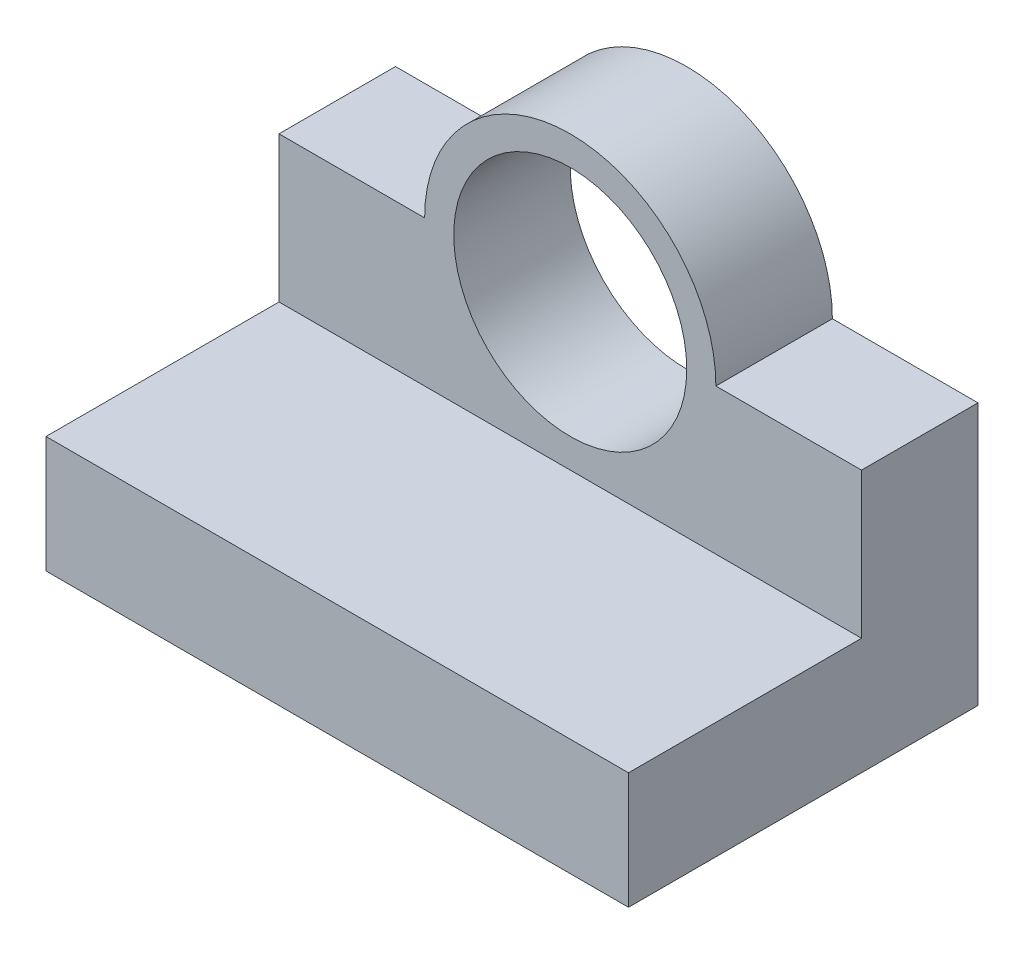
from build123d import *

# Parameters (mm, degrees)
IZIM2_R                     = 20
IZIM2_W                     = 100
IZIM2_H                     = 20
Y_KSEKLIK_EKSTR_ZYON2_DEPTH = 20
IZIM3_W                     = 100
IZIM3_H                     = 20
EKSTR_ZYON_NCE1_DEPTH       = 40


with BuildPart() as part:
    # Çizim2 → Yükseklik-Ekstrüzyon2 (new body)
    # profile 1 of 2: a face of its own
    with BuildSketch(Plane.XY):
        with BuildLine():
            Line((-35.617021277, 12.35106383), (-35.617021277, -12.64893617))
            Line((-35.617021277, -12.64893617), (64.382978723, -12.64893617))
            Line((64.382978723, -12.64893617), (64.382978723, 12.35106383))
            Line((64.382978723, 12.35106383), (39.382978723, 12.35106383))
            ThreePointArc((39.382978723, 12.35106383), (14.382978723, 37.35106383), (-10.617021277, 12.35106383))
            Line((-10.617021277, 12.35106383), (-35.617021277, 12.35106383))
        make_face()
        with Locations((14.382978723, 12.35106383)):
            Circle(IZIM2_R, mode=Mode.SUBTRACT)
    # profile 2 of 2: a face of its own
    with BuildSketch(Plane.XY):
        with Locations((14.382978723, -22.64893617)):
            Rectangle(IZIM2_W, IZIM2_H)
    extrude(amount=Y_KSEKLIK_EKSTR_ZYON2_DEPTH)

    # Çizim3 → Ekstrüzyon-İnce1 (add)
    with BuildSketch(Plane.XY.offset(20)):
        with Locations((14.382978723, -22.64893617)):
            Rectangle(IZIM3_W, IZIM3_H)
    extrude(amount=EKSTR_ZYON_NCE1_DEPTH)


solid = part.part
